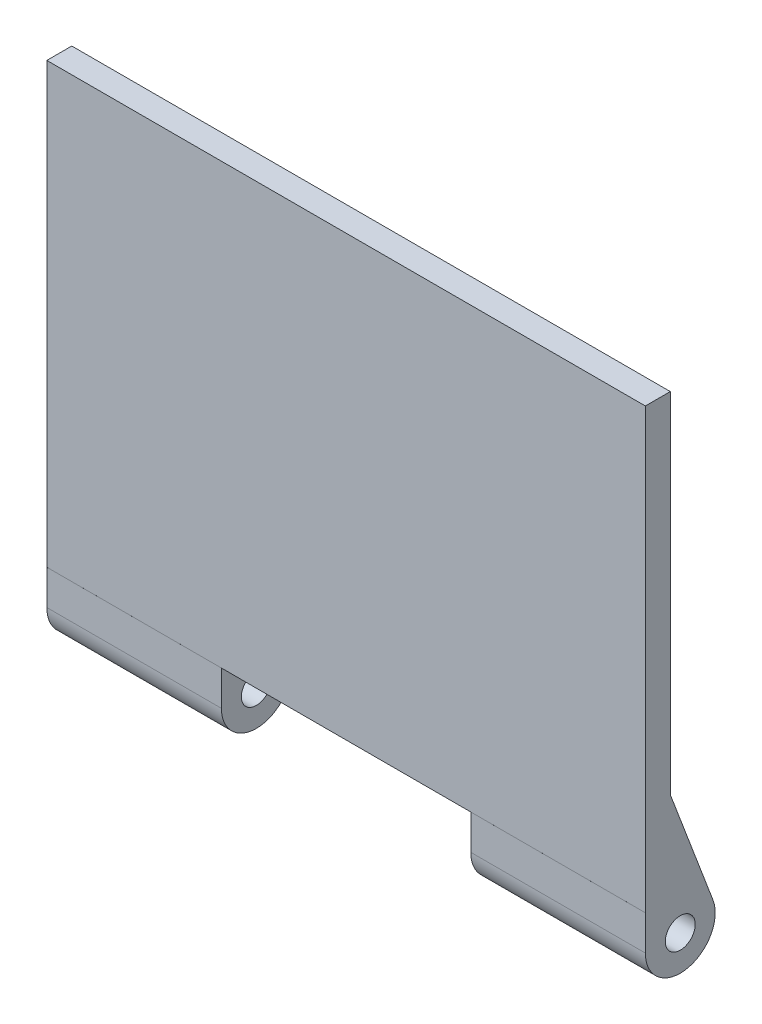
from build123d import *

# Parameters (mm, degrees)
SKETCH_1_W      = 60
SKETCH_1_H      = 44
EXTRUDE_3_DEPTH = 2.5
SKETCH_4_R      = 1.5
EXTRUDE_4_DEPTH = 17.5
EXTRUDE_START   = -17.5
SKETCH_5_R      = 1.5
EXTRUDE_5_DEPTH = 17.5


with BuildPart() as part:
    # 草图1 → 凸台-拉伸3 (new body)
    with BuildSketch(Plane.XY):
        Rectangle(SKETCH_1_W, SKETCH_1_H)
    extrude(amount=EXTRUDE_3_DEPTH)

    # 草图4 → 凸台-拉伸4 (add)
    with BuildSketch(Plane(origin=(30, 0, 0), x_dir=(0, 0, -1), z_dir=(1, 0, 0))):
        with BuildLine():
            Line((0, -22), (0, -13))
            Line((0, -13), (4.271805299, -24.258355855))
            ThreePointArc((4.271805299, -24.258355855), (1.630618235, -28.942618859), (-2.500551622, -25.5))
            Line((-2.500551622, -25.5), (-2.500551622, -22))
            Line((-2.500551622, -22), (0, -22))
        make_face()
        with Locations((0.999448378, -25.5)):
            Circle(SKETCH_4_R, mode=Mode.SUBTRACT)
    extrude(amount=-EXTRUDE_4_DEPTH)

    # 草图5 → 凸台-拉伸5 (add)
    with BuildSketch(Plane.ZY.offset(30).offset(EXTRUDE_START)):
        with BuildLine():
            Line((2.5, -22), (0, -22))
            Line((0, -22), (0, -13))
            Line((0, -13), (-4.271805299, -24.258355855))
            ThreePointArc((-4.271805299, -24.258355855), (-1.630618235, -28.942618859), (2.500551622, -25.5))
            Line((2.500551622, -25.5), (2.5, -22))
        make_face()
        with Locations(Location((-0.999448378, -25.5, 0), (0, 0, 180))):
            Circle(SKETCH_5_R, mode=Mode.SUBTRACT)
    extrude(amount=EXTRUDE_5_DEPTH)


solid = part.part
